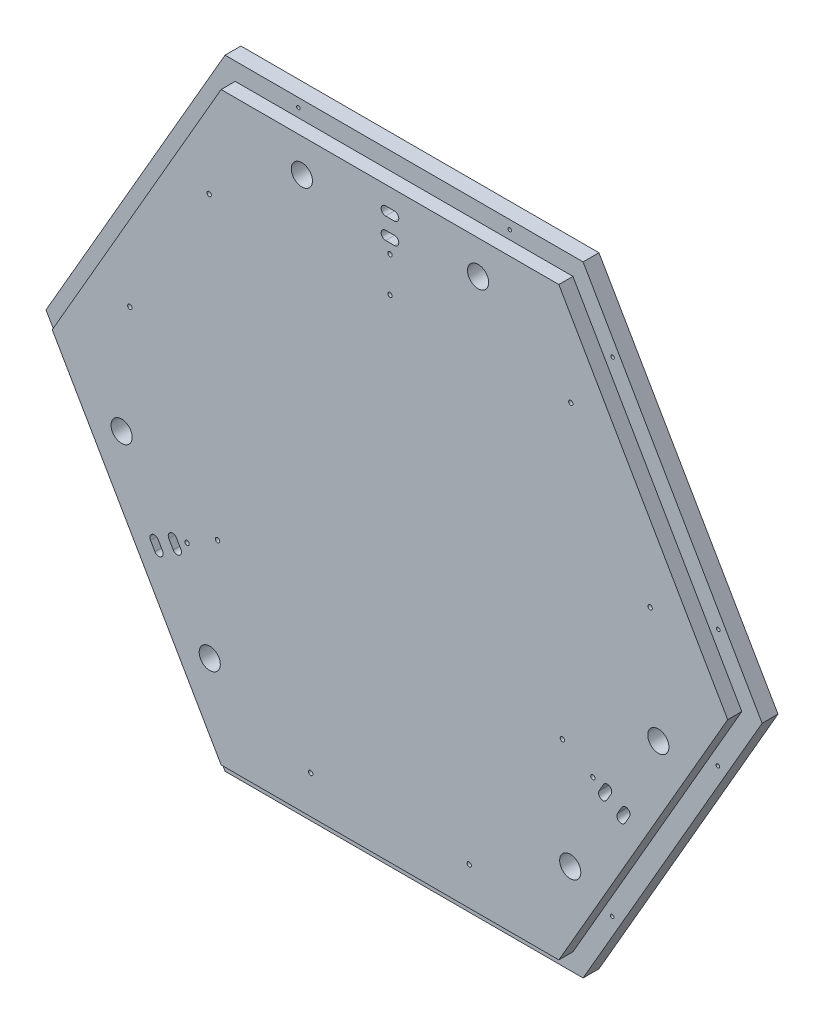
from build123d import *

# Parameters (mm, degrees)
BOSS_EXTRUDE1_DEPTH = 17
SKETCH3_R           = 6
CUT_EXTRUDE1_DEPTH  = 10
SKETCH4_OUTSIDE_W   = 536.486
SKETCH4_OUTSIDE_H   = 479.866
CUT_EXTRUDE2_DEPTH  = 8
SKETCH5_R           = 1.25
CUT_EXTRUDE3_DEPTH  = 281.053566305
SKETCH7_R           = 1.25
CUT_EXTRUDE5_DEPTH  = 281.053566305
CUT_EXTRUDE6_DEPTH  = 281.053566305
SKETCH9_R           = 1
CUT_EXTRUDE7_DEPTH  = 270.381390102


with BuildPart() as part:
    # Sketch1 → Boss-Extrude1 (new body)
    with BuildSketch(Plane.XY):
        Polygon((105.655099262, 183), (-105.655099262, 183), (-211.310198523, 0), (-105.655099262, -183), (105.655099262, -183), (211.310198523, 0), align=None)
    extrude(amount=BOSS_EXTRUDE1_DEPTH)

    # Sketch3 → Cut-Extrude1 (cut)
    with BuildSketch(Plane.XY.offset(17)):
        with Locations((50, 147)):
            Circle(SKETCH3_R)
        with Locations((-50, 147)):
            Circle(SKETCH3_R)
        with Locations((-152.305734356, -30.198729811)):
            Circle(SKETCH3_R)
        with Locations((-102.305734356, -116.801270189)):
            Circle(SKETCH3_R)
        with Locations((102.305734356, -116.801270189)):
            Circle(SKETCH3_R)
        with Locations((152.305734356, -30.198729811)):
            Circle(SKETCH3_R)
    extrude(amount=-CUT_EXTRUDE1_DEPTH, mode=Mode.SUBTRACT)

    # Sketch4 outside → Cut-Extrude2 (cut)
    with BuildSketch(Plane.XY.offset(17)):
        Rectangle(SKETCH4_OUTSIDE_W, SKETCH4_OUTSIDE_H)
        Polygon((191.680289371, 0), (95.840144685, 166), (-95.840144685, 166), (-191.680289371, 0), (-95.840144685, -166), (95.840144685, -166), align=None, mode=Mode.SUBTRACT)
    extrude(amount=-CUT_EXTRUDE2_DEPTH, mode=Mode.SUBTRACT)

    # Sketch5 → Cut-Extrude3 (cut, through all)
    with BuildSketch(Plane.XY.offset(17)):
        with Locations((115.181378703, -66.5)):
            Circle(SKETCH5_R)
        with Locations((97.860870628, -56.5)):
            Circle(SKETCH5_R)
        with Locations((-115.181378703, -66.5)):
            Circle(SKETCH5_R)
        with Locations((-97.860870628, -56.5)):
            Circle(SKETCH5_R)
        with Locations((0, 133)):
            Circle(SKETCH5_R)
        with Locations((0, 113)):
            Circle(SKETCH5_R)
        with BuildLine():
            Line((-121.194518424, -67.084936491), (-118.694518424, -71.415063509))
            ThreePointArc((-118.694518424, -71.415063509), (-119.609581934, -74.830127019), (-123.024645443, -73.915063509))
            Line((-123.024645443, -73.915063509), (-125.524645443, -69.584936491))
            ThreePointArc((-125.524645443, -69.584936491), (-124.609581934, -66.169872981), (-121.194518424, -67.084936491))
        make_face()
        with BuildLine():
            Line((-131.58682327, -73.084936491), (-129.08682327, -77.415063509))
            ThreePointArc((-129.08682327, -77.415063509), (-130.001886779, -80.830127019), (-133.416950288, -79.915063509))
            Line((-133.416950288, -79.915063509), (-135.916950288, -75.584936491))
            ThreePointArc((-135.916950288, -75.584936491), (-135.001886779, -72.169872981), (-131.58682327, -73.084936491))
        make_face()
        with BuildLine():
            Line((118.694518424, -71.415063509), (121.194518424, -67.084936491))
            ThreePointArc((121.194518424, -67.084936491), (124.609581934, -66.169872981), (125.524645443, -69.584936491))
            Line((125.524645443, -69.584936491), (123.024645443, -73.915063509))
            ThreePointArc((123.024645443, -73.915063509), (119.609581934, -74.830127019), (118.694518424, -71.415063509))
        make_face()
        with BuildLine():
            Line((129.08682327, -77.415063509), (131.58682327, -73.084936491))
            ThreePointArc((131.58682327, -73.084936491), (135.001886779, -72.169872981), (135.916950288, -75.584936491))
            Line((135.916950288, -75.584936491), (133.416950288, -79.915063509))
            ThreePointArc((133.416950288, -79.915063509), (130.001886779, -80.830127019), (129.08682327, -77.415063509))
        make_face()
        with BuildLine():
            Line((2.5, 138.5), (-2.5, 138.5))
            ThreePointArc((-2.5, 138.5), (-5, 141), (-2.5, 143.5))
            Line((-2.5, 143.5), (2.5, 143.5))
            ThreePointArc((2.5, 143.5), (5, 141), (2.5, 138.5))
        make_face()
        with BuildLine():
            Line((2.5, 150.5), (-2.5, 150.5))
            ThreePointArc((-2.5, 150.5), (-5, 153), (-2.5, 155.5))
            Line((-2.5, 155.5), (2.5, 155.5))
            ThreePointArc((2.5, 155.5), (5, 153), (2.5, 150.5))
        make_face()
    extrude(amount=-CUT_EXTRUDE3_DEPTH, mode=Mode.SUBTRACT)

    # Sketch7 → Cut-Extrude5 (cut, through all)
    with BuildSketch(Plane(origin=(0, 0, 0), x_dir=(-1, 0, 0), z_dir=(0, 0, -1))):
        with Locations((147.640670847, 33.27885683)):
            Circle(SKETCH7_R)
        with Locations((102.640670847, 111.22114317)):
            Circle(SKETCH7_R)
        with Locations((45, -144.5)):
            Circle(SKETCH7_R)
        with Locations((-45, -144.5)):
            Circle(SKETCH7_R)
        with Locations((-147.640670847, 33.27885683)):
            Circle(SKETCH7_R)
        with Locations((-102.640670847, 111.22114317)):
            Circle(SKETCH7_R)
    extrude(amount=-CUT_EXTRUDE5_DEPTH, mode=Mode.SUBTRACT)

    # Sketch8 → Cut-Extrude6 (cut, through all)
    with BuildSketch(Plane(origin=(0, 0, 0), x_dir=(-1, 0, 0), z_dir=(0, 0, -1))):
        Polygon((105.655099262, 183), (-105.655099262, 183), (-211.310198523, 0), (-105.655099262, -183), (105.655099262, -183), (211.310198523, 0), align=None)
        Polygon((101.613647377, 176), (-101.613647377, 176), (-203.227294755, 0), (-101.613647377, -176), (101.613647377, -176), (203.227294755, 0), align=None, mode=Mode.SUBTRACT)
    extrude(amount=-CUT_EXTRUDE6_DEPTH, mode=Mode.SUBTRACT)

    # Sketch9 → Cut-Extrude7 (cut, through all)
    with BuildSketch(Plane(origin=(0, 0, 0), x_dir=(-1, 0, 0), z_dir=(0, 0, -1))):
        with Locations((-118.35021945, 137.610699371)):
            Circle(SKETCH9_R)
        with Locations((-178.349471213, 33.688946902)):
            Circle(SKETCH9_R)
        with Locations((-178.090344047, -33.538475773)):
            Circle(SKETCH9_R)
        with Locations((-118.090344047, -137.461524227)):
            Circle(SKETCH9_R)
        with Locations((-60, -171)):
            Circle(SKETCH9_R)
        with Locations((60, -171)):
            Circle(SKETCH9_R)
        with Locations((118.35021945, -137.610699371)):
            Circle(SKETCH9_R)
        with Locations((178.349471213, -33.688946902)):
            Circle(SKETCH9_R)
        with Locations(Location((60, 171, 0), (0, 0, 180))):
            Circle(SKETCH9_R)
        with Locations(Location((-60, 171, 0), (0, 0, 180))):
            Circle(SKETCH9_R)
    extrude(amount=-CUT_EXTRUDE7_DEPTH, mode=Mode.SUBTRACT)


solid = part.part
